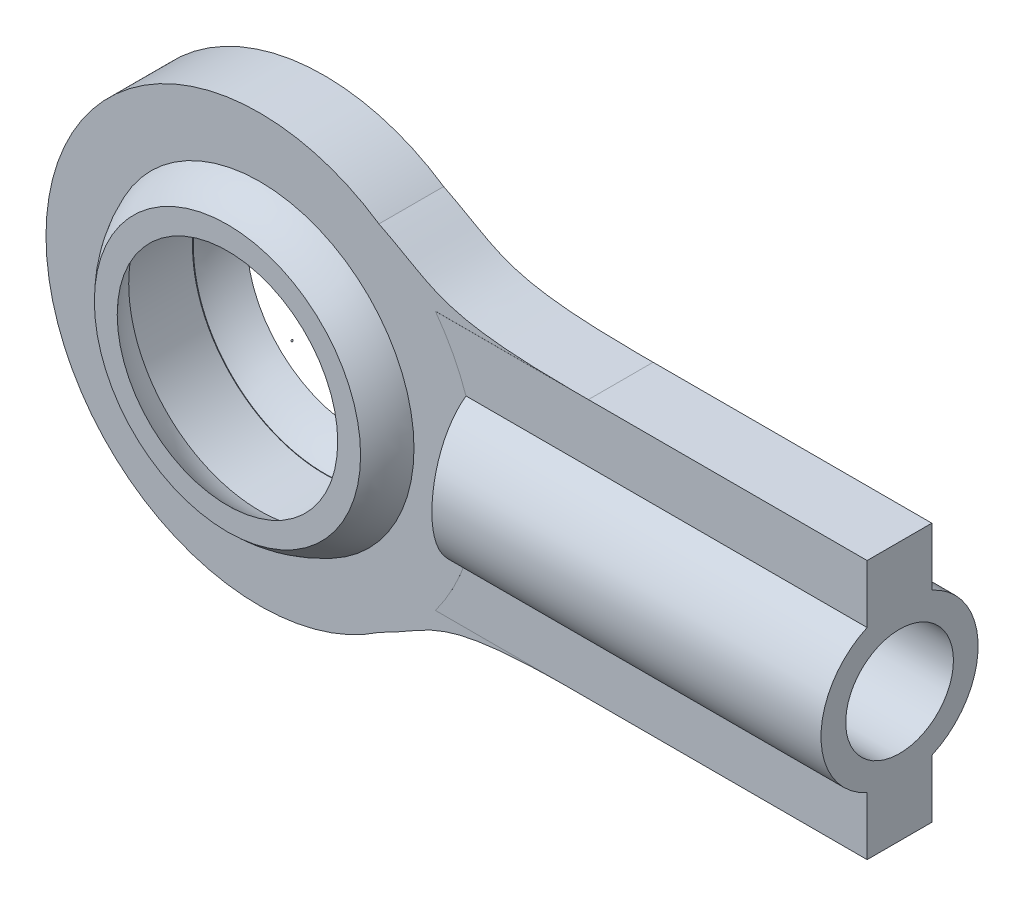
from build123d import *

# Parameters (mm, degrees)
BOSS_EXTRUDE3_DEPTH = 10
SKETCH2_R           = 13.5
CUT_EXTRUDE1_DEPTH  = 3
CUT_EXTRUDE2_START  = -3
SKETCH3_R           = 13.5
CUT_EXTRUDE2_DEPTH  = 3
CUT_EXTRUDE5_DEPTH  = 29
SKETCH9_W           = 3
SKETCH9_H           = 2.048086508
SKETCH9_H_2         = 2.048086509
CUT_EXTRUDE6_DEPTH  = 42.048348906
SKETCH14_R          = 3.33
CUT_EXTRUDE11_DEPTH = 24
SKETCH16_R          = 8.139933756
CUT_EXTRUDE13_DEPTH = 4


with BuildPart() as part:
    # Sketch1 → Boss-Extrude3 (new body)
    with BuildSketch(Plane.XY):
        with BuildLine():
            Line((37.55982311, -8.009746942), (37.55982311, 8.009746942))
            Line((37.55982311, 8.009746942), (20.326448254, 8.009746942))
            add(Edge.make_bspline(
                [(7.372051465, 10.937502329), (11.059345851, 9.112439697), (10.936096799, 7.960936917), (20.326448254, 8.009746942)],
                knots=[0, 0, 0, 0, 1, 1, 1, 1], degree=3))
            ThreePointArc((7.372051465, 10.937502329), (-13.216465231, 0), (7.372051465, -10.937502329))
            add(Edge.make_bspline(
                [(7.372051465, -10.937502329), (11.059345851, -9.112439697), (10.936096799, -7.960936917), (20.326448254, -8.009746942)],
                knots=[0, 0, 0, 0, 1, 1, 1, 1], degree=3))
            Line((20.326448254, -8.009746942), (37.55982311, -8.009746942))
        make_face()
    extrude(amount=BOSS_EXTRUDE3_DEPTH)

    # Sketch2 → Cut-Extrude1 (cut)
    with BuildSketch(Plane.XY.offset(10)):
        Circle(SKETCH2_R)
    extrude(amount=-CUT_EXTRUDE1_DEPTH, mode=Mode.SUBTRACT)

    # Sketch3 → Cut-Extrude2 (cut)
    with BuildSketch(Plane(origin=(0, 0, 0), x_dir=(-1, 0, 0), z_dir=(0, 0, -1)).offset(CUT_EXTRUDE2_START)):
        Circle(SKETCH3_R)
    extrude(amount=CUT_EXTRUDE2_DEPTH, mode=Mode.SUBTRACT)

    # Sketch7 → Cut-Extrude5 (cut)
    with BuildSketch(Plane(origin=(37.55982311, 0, 0), x_dir=(0, 0, -1), z_dir=(1, 0, 0))):
        with BuildLine():
            Line((-7.004118926, -8.009746942), (-10, -8.009746942))
            Line((-10, -8.009746942), (-10, 8.009746942))
            Line((-10, 8.009746942), (-7.004118926, 8.009746942))
            Line((-7.004118926, 8.009746942), (-7.004118926, 4.419975285))
            ThreePointArc((-7.004118926, 4.419975285), (-9.855660749, 0), (-7.004118926, -4.419975285))
            Line((-7.004118926, -4.419975285), (-7.004118926, -8.009746942))
        make_face()
        with BuildLine():
            Line((0, 8.009746942), (-3.003702566, 8.009746942))
            Line((-3.003702566, 8.009746942), (-3.003702566, 4.423513393))
            ThreePointArc((-3.003702566, 4.423513393), (-0.139158307, 0), (-3.003702566, -4.423513393))
            Line((-3.003702566, -4.423513393), (-3.003702566, -8.009746942))
            Line((-3.003702566, -8.009746942), (0, -8.009746942))
            Line((0, -8.009746942), (0, 8.009746942))
        make_face()
    extrude(amount=-CUT_EXTRUDE5_DEPTH, mode=Mode.SUBTRACT)

    # Sketch9 → Cut-Extrude6 (cut, through all)
    with BuildSketch(Plane(origin=(0, 0, 0), x_dir=(0, 0, -1), z_dir=(1, 0, 0))):
        with Locations((-8.5, 9.033790196)):
            Rectangle(SKETCH9_W, SKETCH9_H)
        with Locations((-8.5, -9.033790197)):
            Rectangle(SKETCH9_W, SKETCH9_H_2)
        with Locations((-1.5, 9.033790196)):
            Rectangle(SKETCH9_W, SKETCH9_H)
        with Locations((-1.5, -9.033790196)):
            Rectangle(SKETCH9_W, SKETCH9_H)
    extrude(amount=CUT_EXTRUDE6_DEPTH, mode=Mode.SUBTRACT)

    # Sketch14 → Cut-Extrude11 (cut)
    with BuildSketch(Plane(origin=(37.55982311, 0, 0), x_dir=(0, 0, -1), z_dir=(1, 0, 0))):
        with Locations((-4.997409528, 0)):
            Circle(SKETCH14_R)
    extrude(amount=-CUT_EXTRUDE11_DEPTH, mode=Mode.SUBTRACT)

    # Sketch15 → Revolve5 (revolve)
    with BuildSketch(Plane(origin=(0, 0, 0), x_dir=(1, 0, 0), z_dir=(0, 1, 0)), mode=Mode.PRIVATE) as revolve5_sk:
        with BuildLine():
            ThreePointArc((-6.80673286, -0.993463285), (-8.466294705, -5), (-6.80673286, -9.006536715))
            Line((-6.80673286, -9.006536715), (-8.220874534, -9.006536715))
            ThreePointArc((-8.220874534, -9.006536715), (-9.88043638, -5), (-8.220874534, -0.993463285))
            Line((-8.220874534, -0.993463285), (-6.80673286, -0.993463285))
        make_face()
    revolve(revolve5_sk.sketch.rotate(Axis((0.010690819, 0, 9.006536715), (0, 0, -1)), 180), axis=Axis((0.010690819, 0, 9.006536715), (0, 0, -1)))

    # Sketch16 → Cut-Extrude13 (cut)
    with BuildSketch(Plane(origin=(0, 0, 3), x_dir=(-1, 0, 0), z_dir=(0, 0, -1))):
        with Locations(Location((0.016971917, 0, 0), (0, 0, 180.004863608))):
            Circle(SKETCH16_R)
    extrude(amount=-CUT_EXTRUDE13_DEPTH, mode=Mode.SUBTRACT)


with BuildPart() as body_2:
    # Sketch18 → Revolve7 (revolve)
    with BuildSketch(Plane.XY.offset(5)):
        with BuildLine():
            Line((0, 0.05), (0, -0.05))
            ThreePointArc((0, -0.05), (-0.05, 0), (0, 0.05))
        make_face()
    revolve(axis=Axis((0, 0.05, 5), (0, -1, 0)))


solid = Compound([part.part, body_2.part])
